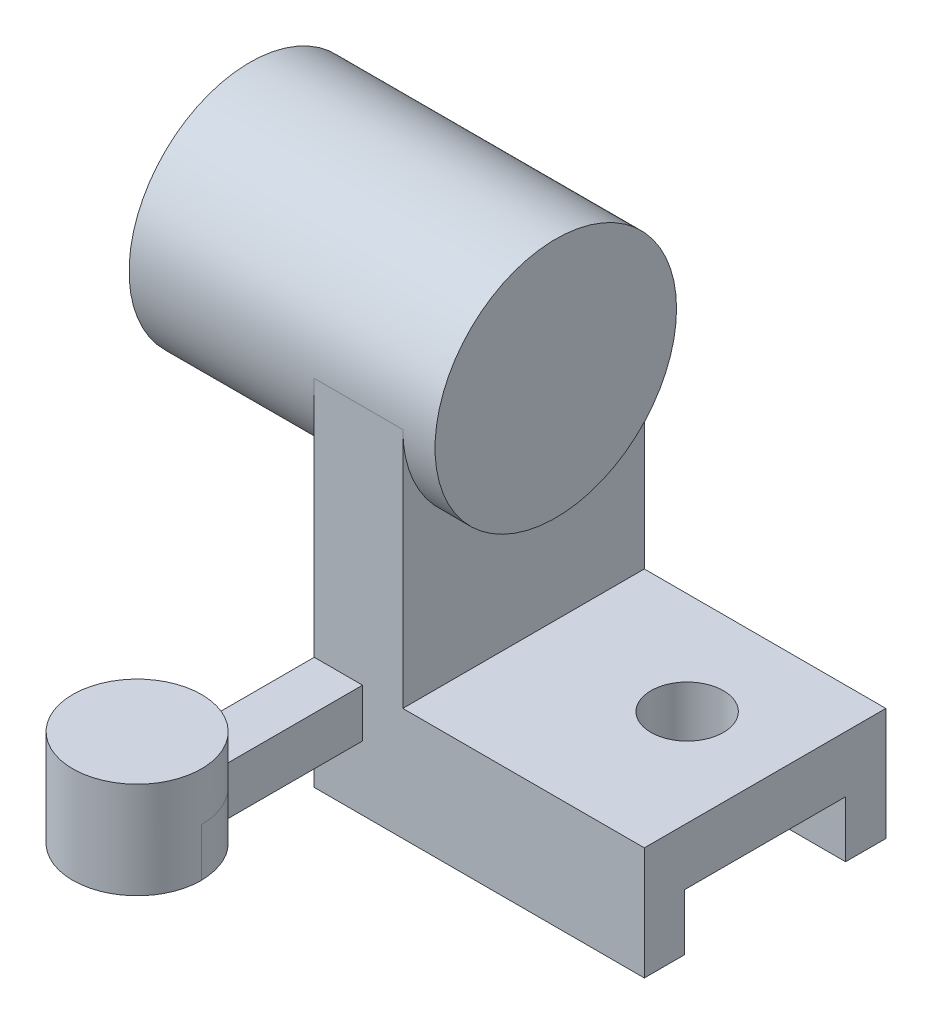
from build123d import *

# Parameters (mm, degrees)
SKETCH1_W            = 60
SKETCH1_H            = 60
BOSS_EXTRUDE1_DEPTH  = 28
CUT_EXTRUDE1_REACH   = 81.433
SKETCH2_W            = 40
SKETCH2_H            = 14
CUT_EXTRUDE2_REACH   = 63.555
SKETCH3_R            = 9
SKETCH4_W            = 60
SKETCH4_H            = 60
BOSS_EXTRUDE2_DEPTH  = 22
SKETCH5_W            = 60
SKETCH5_H            = 28
BOSS_EXTRUDE3_DEPTH  = 22
SKETCH6_R            = 30
BOSS_EXTRUDE5_DEPTH  = 68
BOSS_EXTRUDE6_START  = 8
SKETCH8_R            = 30
BOSS_EXTRUDE6_DEPTH  = 8
SKETCH9_W            = 12
SKETCH9_H            = 12
BOSS_EXTRUDE8_DEPTH  = 50
SKETCH10_R           = 16
BOSS_EXTRUDE9_DEPTH  = 12
BOSS_EXTRUDE10_START = 12
BOSS_EXTRUDE10_DEPTH = 12
BOSS_EXTRUDE11_DEPTH = 12
BOSS_EXTRUDE12_DEPTH = 12


with BuildPart() as part:
    # Sketch1 → Boss-Extrude1 (new body)
    with BuildSketch(Plane(origin=(0, 0, 0), x_dir=(1, 0, 0), z_dir=(0, 1, 0))):
        with Locations((2.853470437, -13.881748072)):
            Rectangle(SKETCH1_W, SKETCH1_H)
    extrude(amount=-BOSS_EXTRUDE1_DEPTH)

    # Sketch2 → Cut-Extrude1 (cut, up to next)
    with BuildSketch(Plane(origin=(32.853470437, 0, 0), x_dir=(0, 0, -1), z_dir=(1, 0, 0)), mode=Mode.PRIVATE) as cut_extrude1_sk1:
        with Locations((-13.881748072, -21)):
            Rectangle(SKETCH2_W, SKETCH2_H)
    cut_extrude1_tool1 = extrude(cut_extrude1_sk1.sketch, amount=-CUT_EXTRUDE1_REACH, mode=Mode.PRIVATE) & part.part
    add(cut_extrude1_tool1.solids().sort_by_distance((32.85347, -21, 13.881748))[0], mode=Mode.SUBTRACT)

    # Sketch3 → Cut-Extrude2 (cut, up to next)
    with BuildSketch(Plane(origin=(0, 0, 0), x_dir=(1, 0, 0), z_dir=(0, 1, 0)), mode=Mode.PRIVATE) as cut_extrude2_sk1:
        with Locations(Location((8.853470437, -9.237836832, 0), (0, 0, 270))):
            Circle(SKETCH3_R)
    cut_extrude2_tool1 = extrude(cut_extrude2_sk1.sketch, amount=-CUT_EXTRUDE2_REACH, mode=Mode.PRIVATE) & part.part
    add(cut_extrude2_tool1.solids().sort_by_distance((8.85347, 0, 9.237837))[0], mode=Mode.SUBTRACT)



with BuildPart() as body_2:
    # Sketch4 → Boss-Extrude2 (new body)
    with BuildSketch(Plane.ZY.offset(27.146529563)):
        with Locations((13.881748072, 30)):
            Rectangle(SKETCH4_W, SKETCH4_H)
    extrude(amount=BOSS_EXTRUDE2_DEPTH)


with BuildPart() as part_1:
    add(part.part)

    add(body_2.part)  # Boss-Extrude3 merges body 2
    # Sketch5 → Boss-Extrude3 (add)
    with BuildSketch(Plane.ZY.offset(49.146529563)):
        with Locations((13.881748072, -14)):
            Rectangle(SKETCH5_W, SKETCH5_H)
    extrude(amount=-BOSS_EXTRUDE3_DEPTH)

    # Sketch6 → Boss-Extrude5 (add)
    with BuildSketch(Plane(origin=(-27.146529563, 0, 0), x_dir=(0, 0, -1), z_dir=(1, 0, 0))):
        with Locations((-13.881748072, 60)):
            Circle(SKETCH6_R)
    extrude(amount=-BOSS_EXTRUDE5_DEPTH)

    # Sketch8 → Boss-Extrude6 (add)
    with BuildSketch(Plane(origin=(-27.146529563, 0, 0), x_dir=(0, 0, -1), z_dir=(1, 0, 0)).offset(BOSS_EXTRUDE6_START)):
        with Locations((-13.881748072, 60)):
            Circle(SKETCH8_R)
    extrude(amount=-BOSS_EXTRUDE6_DEPTH)

    # Sketch9 → Boss-Extrude8 (add)
    with BuildSketch(Plane.XY.offset(43.881748072)):
        with Locations((-43.146529563, -6)):
            Rectangle(SKETCH9_W, SKETCH9_H)
    extrude(amount=BOSS_EXTRUDE8_DEPTH)

    # Sketch10 → Boss-Extrude9 (add)
    with BuildSketch(Plane(origin=(0, 0, 0), x_dir=(1, 0, 0), z_dir=(0, 1, 0))):
        with Locations(Location((-43.146529563, -93.881748072, 0), (0, 0, 67.975687163))):
            Circle(SKETCH10_R)
    extrude(amount=BOSS_EXTRUDE9_DEPTH)

    # Sketch11 → Boss-Extrude10 (add)
    with BuildSketch(Plane.XZ.offset(BOSS_EXTRUDE10_START)):
        with BuildLine():
            ThreePointArc((-27.146529563, 93.881748072), (-43.146529563, 109.881748072), (-59.146529563, 93.881748072))
            Line((-59.146529563, 93.881748072), (-49.146529563, 93.881748072))
            Line((-49.146529563, 93.881748072), (-37.146529563, 93.881748072))
            Line((-37.146529563, 93.881748072), (-27.146529563, 93.881748072))
        make_face()
    extrude(amount=-BOSS_EXTRUDE10_DEPTH)

    # Sketch12 → Boss-Extrude11 (add)
    with BuildSketch(Plane.XZ):
        with BuildLine():
            Line((-27.146529563, 93.881748072), (-37.146529563, 93.881748072))
            Line((-37.146529563, 93.881748072), (-37.146529563, 79.049351098))
            add(Edge.make_bspline(
                [(-27.146529563, 93.881748072), (-27.61353124, 83.409402739), (-37.146529563, 79.049351098)],
                knots=[0, 0, 0, 1, 1, 1], degree=2))
        make_face()
    extrude(amount=BOSS_EXTRUDE11_DEPTH)

    # Sketch13 → Boss-Extrude12 (add)
    with BuildSketch(Plane.XZ):
        with BuildLine():
            Line((-59.146529563, 93.881748072), (-49.146529563, 93.881748072))
            Line((-49.146529563, 93.881748072), (-49.146529563, 79.049351098))
            add(Edge.make_bspline(
                [(-59.146529563, 93.881748072), (-58.679527886, 83.409402739), (-49.146529563, 79.049351098)],
                knots=[0, 0, 0, 1, 1, 1], degree=2))
        make_face()
    extrude(amount=BOSS_EXTRUDE12_DEPTH)


solid = part_1.part
